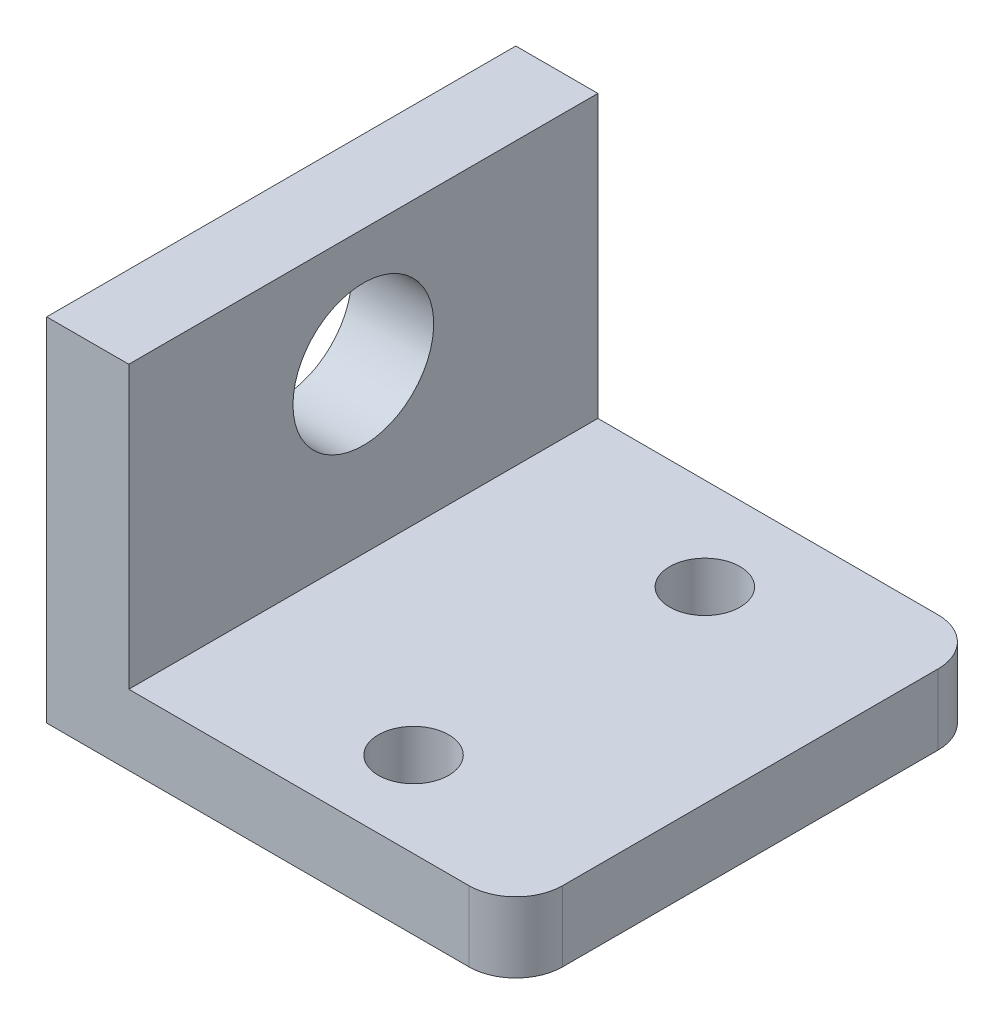
from build123d import *

# Parameters (mm, degrees)
SKETCH1_W           = 20
SKETCH1_H           = 20
BOSS_EXTRUDE1_DEPTH = 3
SKETCH2_W           = 3.5
SKETCH2_H           = 20
BOSS_EXTRUDE2_DEPTH = 12
SKETCH3_R           = 3
CUT_EXTRUDE1_DEPTH  = 12
FILLET1_R           = 2
SKETCH4_R           = 1.5
CUT_EXTRUDE2_DEPTH  = 12


with BuildPart() as part:
    # Sketch1 → Boss-Extrude1 (new body)
    with BuildSketch(Plane(origin=(0, 0, 0), x_dir=(1, 0, 0), z_dir=(0, 1, 0))):
        Rectangle(SKETCH1_W, SKETCH1_H)
    extrude(amount=BOSS_EXTRUDE1_DEPTH)

    # Sketch2 → Boss-Extrude2 (add)
    with BuildSketch(Plane(origin=(0, 3, 0), x_dir=(1, 0, 0), z_dir=(0, 1, 0))):
        with Locations((-8.25, 0)):
            Rectangle(SKETCH2_W, SKETCH2_H)
    extrude(amount=BOSS_EXTRUDE2_DEPTH)

    # Sketch3 → Cut-Extrude1 (cut)
    with BuildSketch(Plane.ZY.offset(10)):
        with Locations((0, 10)):
            Circle(SKETCH3_R)
    extrude(amount=-CUT_EXTRUDE1_DEPTH, mode=Mode.SUBTRACT)

    # Fillet1
    fillet1_edges = [part.edges().sort_by_distance(p)[0] for p in [
        (10, 1.5, -10),
        (10, 1.5, 10),
    ]]
    fillet(fillet1_edges, radius=FILLET1_R)

    # Sketch4 → Cut-Extrude2 (cut)
    with BuildSketch(Plane(origin=(0, 3, 0), x_dir=(1, 0, 0), z_dir=(0, 1, 0))):
        with Locations(Location((2, 6.060166803, 0), (0, 0, 270))):
            Circle(SKETCH4_R)
        with Locations(Location((2, -6.359845381, 0), (0, 0, 270))):
            Circle(SKETCH4_R)
    extrude(amount=-CUT_EXTRUDE2_DEPTH, mode=Mode.SUBTRACT)


solid = part.part
